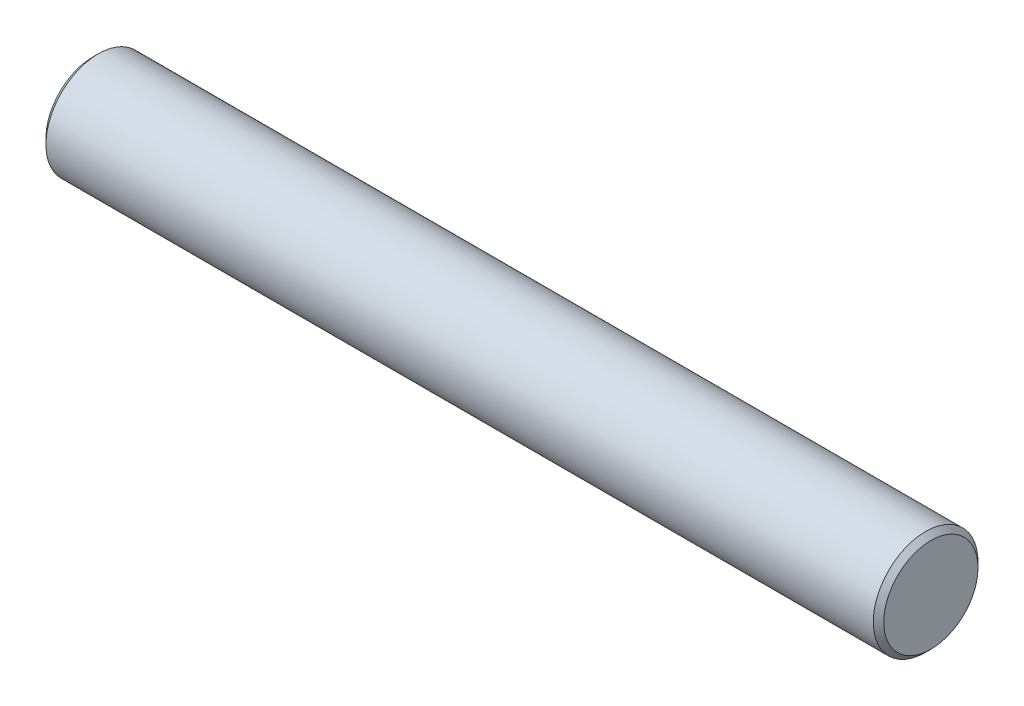
from build123d import *

# Parameters (mm, degrees)
SKETCH1_R           = 2.5
BOSS_EXTRUDE1_DEPTH = 20
CHAMFER1_SIZE       = 0.25


with BuildPart() as part:
    # Sketch1 → Boss-Extrude1 (new, symmetric)
    with BuildSketch(Plane(origin=(0, 0, 0), x_dir=(0, 0, -1), z_dir=(1, 0, 0))):
        Circle(SKETCH1_R)
    extrude(amount=BOSS_EXTRUDE1_DEPTH, both=True)

    # Chamfer1
    chamfer1_edges = [part.edges().sort_by_distance(p)[0] for p in [
        (-20, 0, 2.5),
        (20, 0, 2.5),
    ]]
    chamfer(chamfer1_edges, length=CHAMFER1_SIZE)


solid = part.part
